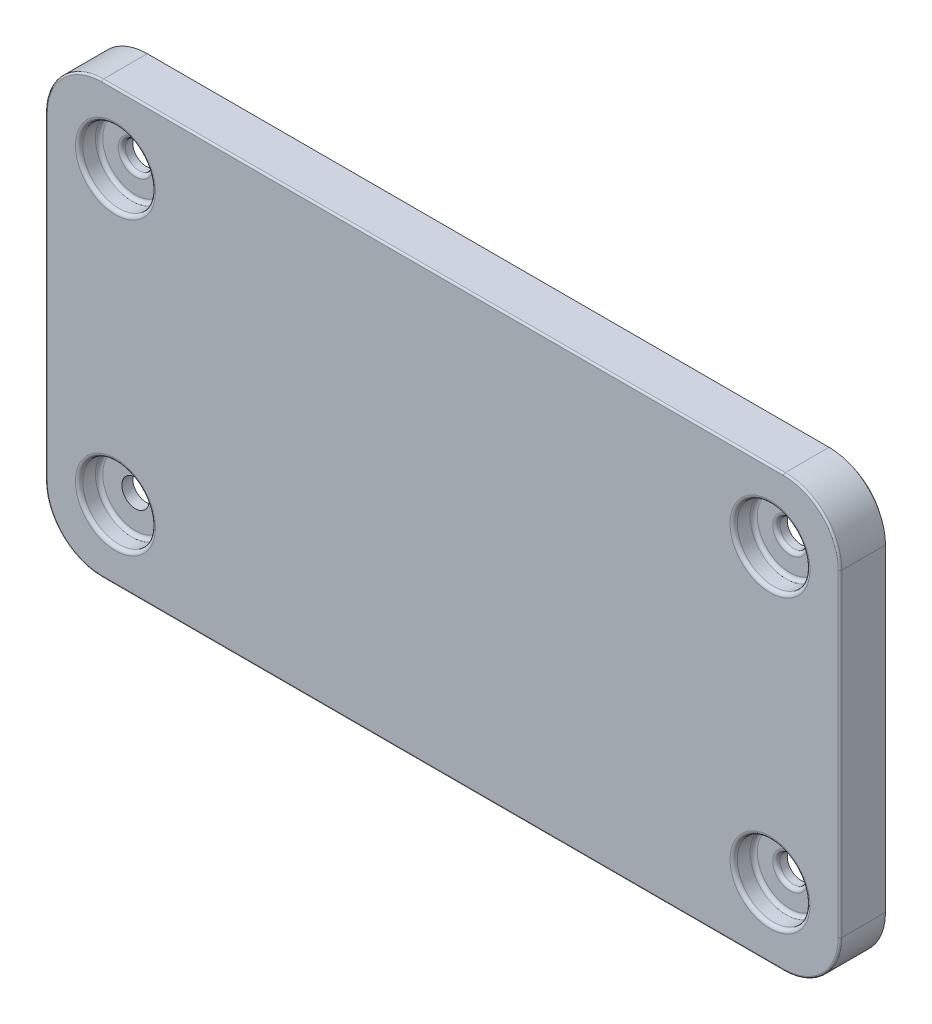
from build123d import *

# Parameters (mm, degrees)
EXTRUDE_1_DEPTH     = 5
EXTRUDE_START       = -1.2
EXTRUDE_2_DEPTH     = 1.2
SKETCH_4_R          = 4
SKETCH_4_R_2        = 1.5
EXTRUDE_3_DEPTH     = 1.2
EXTRUDE_3_2_DEPTH   = 1.2
EXTRUDE_3_3_DEPTH   = 1.2
EXTRUDE_3_4_DEPTH   = 1.2
EXTRUDE_4_REACH     = 96.482
SKETCH_5_R          = 5.2
SKETCH_5_R_2        = 4
SKETCH_6_R          = 4
CUT_EXTRUDE_1_DEPTH = 95.46279818
EXTRUDE_START_2     = 0.6
EXTRUDE_5_DEPTH     = 0.6
CUT_EXTRUDE_2_REACH = 97.858
SKETCH_8_W          = 7.940000079
SKETCH_8_H          = 0.6
CUT_EXTRUDE_3_REACH = 98.25
SKETCH_9_W          = 10.760001831
SKETCH_9_H          = 0.6
SKETCH_9_W_2        = 10.759988403
SKETCH_10_W         = 10.760001831
SKETCH_10_H         = 0.4
SKETCH_10_W_2       = 0.4
SKETCH_10_W_3       = 10.759988403
EXTRUDE_6_DEPTH     = 2.099999937
SKETCH_11_W         = 7.940000079
SKETCH_11_H         = 0.4
SKETCH_11_W_2       = 0.4
EXTRUDE_7_DEPTH     = 2.099999937
FILLET_1_R          = 0.4
FILLET_2_R          = 1.5
FILLET_3_R          = 0.2
CUT_EXTRUDE_4_DEPTH = 0.6


with BuildPart() as part:
    # 草图1 → 凸台-拉伸1 (new body)
    with BuildSketch(Plane.XY.offset(-1.60003744)):
        with BuildLine():
            ThreePointArc((3.699999975, 37.499457172), (1.884295867, 41.884295867), (-2.500542828, 43.699999975))
            Line((-2.500542828, 43.699999975), (-77.499459801, 43.699999975))
            ThreePointArc((-77.499459801, 43.699999975), (-81.884294734, 41.884294734), (-83.699999975, 37.499459801))
            Line((-83.699999975, 37.499459801), (-83.699999975, 2.500538401))
            ThreePointArc((-83.699999975, 2.500538401), (-81.884293959, -1.884293959), (-77.499461599, -3.699999975))
            Line((-77.499461599, -3.699999975), (-2.500541029, -3.699999975))
            ThreePointArc((-2.500541029, -3.699999975), (1.884295092, -1.884295092), (3.699999975, 2.500541029))
            Line((3.699999975, 2.500541029), (3.699999975, 37.499457172))
        make_face()
        with BuildLine():
            Line((2.499999937, 2.500397821), (2.499999936, 37.499600856))
            ThreePointArc((2.499999936, 37.499600856), (1.035767701, 41.035767701), (-2.500399144, 42.499999936))
            Line((-2.500399144, 42.499999936), (-77.499602789, 42.499999937))
            ThreePointArc((-77.499602789, 42.499999937), (-81.035766569, 41.035766569), (-82.499999937, 37.499602789))
            Line((-82.499999937, 37.499602789), (-82.499999937, 2.500395888))
            ThreePointArc((-82.499999937, 2.500395888), (-81.035765794, -1.035765794), (-77.499604112, -2.499999937))
            Line((-77.499604112, -2.499999937), (-2.500397821, -2.499999937))
            ThreePointArc((-2.500397821, -2.499999937), (1.035766926, -1.035766926), (2.499999937, 2.500397821))
        make_face(mode=Mode.SUBTRACT)
    extrude(amount=EXTRUDE_1_DEPTH)

    # 草图3 → 凸台-拉伸2 (add)
    with BuildSketch(Plane.XY.offset(3.39996256).offset(EXTRUDE_START)):
        with BuildLine():
            Line((-2.500542828, 43.699999975), (-77.499459801, 43.699999975))
            ThreePointArc((-77.499459801, 43.699999975), (-81.884294734, 41.884294734), (-83.699999975, 37.499459801))
            Line((-83.699999975, 37.499459801), (-83.699999975, 2.500538401))
            ThreePointArc((-83.699999975, 2.500538401), (-81.884293959, -1.884293959), (-77.499461599, -3.699999975))
            Line((-77.499461599, -3.699999975), (-2.500541029, -3.699999975))
            ThreePointArc((-2.500541029, -3.699999975), (1.884295092, -1.884295092), (3.699999975, 2.500541029))
            Line((3.699999975, 2.500541029), (3.699999975, 37.499457172))
            ThreePointArc((3.699999975, 37.499457172), (1.884295867, 41.884295867), (-2.500542828, 43.699999975))
        make_face()
    extrude(amount=EXTRUDE_2_DEPTH)

    # 草图5 → 凸台-拉伸4 (add, up to next)
    with BuildSketch(Plane(origin=(0, 0, 0), x_dir=(-1, 0, 0), z_dir=(0, 0, -1)), mode=Mode.PRIVATE) as extrude_4_sk1:
        with Locations((76.0000004, 3.99999962)):
            Circle(SKETCH_5_R)
        with Locations((76.0000004, 3.99999962)):
            Circle(SKETCH_5_R_2, mode=Mode.SUBTRACT)
    extrude_4_tool1 = extrude(extrude_4_sk1.sketch, amount=-EXTRUDE_4_REACH, mode=Mode.PRIVATE) - part.part
    # 草图5 → 凸台-拉伸4 (add, up to next)
    with BuildSketch(Plane(origin=(0, 0, 0), x_dir=(-1, 0, 0), z_dir=(0, 0, -1)), mode=Mode.PRIVATE) as extrude_4_sk2:
        with Locations((3.999992, 3.9999793)):
            Circle(SKETCH_5_R)
        with Locations((3.999992, 3.9999793)):
            Circle(SKETCH_5_R_2, mode=Mode.SUBTRACT)
    extrude_4_tool2 = extrude(extrude_4_sk2.sketch, amount=-EXTRUDE_4_REACH, mode=Mode.PRIVATE) - part.part
    # 草图5 → 凸台-拉伸4 (add, up to next)
    with BuildSketch(Plane(origin=(0, 0, 0), x_dir=(-1, 0, 0), z_dir=(0, 0, -1)), mode=Mode.PRIVATE) as extrude_4_sk3:
        with Locations((3.99999962, 35.99999912)):
            Circle(SKETCH_5_R)
        with Locations((3.99999962, 35.99999912)):
            Circle(SKETCH_5_R_2, mode=Mode.SUBTRACT)
    extrude_4_tool3 = extrude(extrude_4_sk3.sketch, amount=-EXTRUDE_4_REACH, mode=Mode.PRIVATE) - part.part
    # 草图5 → 凸台-拉伸4 (add, up to next)
    with BuildSketch(Plane(origin=(0, 0, 0), x_dir=(-1, 0, 0), z_dir=(0, 0, -1)), mode=Mode.PRIVATE) as extrude_4_sk4:
        with Locations((76.0000004, 35.99999912)):
            Circle(SKETCH_5_R)
        with Locations((76.0000004, 35.99999912)):
            Circle(SKETCH_5_R_2, mode=Mode.SUBTRACT)
    extrude_4_tool4 = extrude(extrude_4_sk4.sketch, amount=-EXTRUDE_4_REACH, mode=Mode.PRIVATE) - part.part


with BuildPart() as body_2:
    # 草图4 → 凸台-拉伸3 (new body)
    with BuildSketch(Plane.XY):
        with Locations((-76.0000004, 35.99999912)):
            Circle(SKETCH_4_R)
        with Locations((-76.0000004, 35.99999912)):
            Circle(SKETCH_4_R_2, mode=Mode.SUBTRACT)
    extrude(amount=EXTRUDE_3_DEPTH)


with BuildPart() as body_3:
    # 草图4 → Extrude 3 2 (new body)
    with BuildSketch(Plane.XY):
        with Locations((-3.99999962, 35.99999912)):
            Circle(SKETCH_4_R)
        with Locations((-3.99999962, 35.99999912)):
            Circle(SKETCH_4_R_2, mode=Mode.SUBTRACT)
    extrude(amount=EXTRUDE_3_2_DEPTH)


with BuildPart() as body_4:
    # 草图4 → Extrude 3 3 (new body)
    with BuildSketch(Plane.XY):
        with Locations((-76.0000004, 3.99999962)):
            Circle(SKETCH_4_R)
        with Locations((-76.0000004, 3.99999962)):
            Circle(SKETCH_4_R_2, mode=Mode.SUBTRACT)
    extrude(amount=EXTRUDE_3_3_DEPTH)


with BuildPart() as body_5:
    # 草图4 → Extrude 3 4 (new body)
    with BuildSketch(Plane.XY):
        with Locations((-3.999992, 3.9999793)):
            Circle(SKETCH_4_R)
        with Locations((-3.999992, 3.9999793)):
            Circle(SKETCH_4_R_2, mode=Mode.SUBTRACT)
    extrude(amount=EXTRUDE_3_4_DEPTH)


with BuildPart() as part_1:
    add(part.part)

    add(body_2.part)  # 凸台-拉伸4 merges body 2

    add(body_3.part)  # 凸台-拉伸4 merges body 3

    add(body_4.part)  # 凸台-拉伸4 merges body 4

    add(body_5.part)  # 凸台-拉伸4 merges body 5
    add(extrude_4_tool1.solids().sort_by_distance((-70.947079, 4, 0))[0])
    add(extrude_4_tool2.solids().sort_by_distance((1.05293, 3.999979, 0))[0])
    add(extrude_4_tool3.solids().sort_by_distance((1.052922, 35.999999, 0))[0])
    add(extrude_4_tool4.solids().sort_by_distance((-70.947079, 35.999999, 0))[0])

    # 草图6 → 切除-拉伸1 (cut, through all)
    with BuildSketch(Plane.XY.offset(1.2)):
        with Locations(Location((-76.0000004, 3.99999962, 0), (0, 0, 180))):
            Circle(SKETCH_6_R)
        with Locations(Location((-3.999992, 3.9999793, 0), (0, 0, 180))):
            Circle(SKETCH_6_R)
        with Locations(Location((-3.99999962, 35.99999912, 0), (0, 0, 180))):
            Circle(SKETCH_6_R)
        with Locations(Location((-76.0000004, 35.99999912, 0), (0, 0, 180))):
            Circle(SKETCH_6_R)
    extrude(amount=CUT_EXTRUDE_1_DEPTH, mode=Mode.SUBTRACT)

    # 草图7 → 凸台-拉伸5 (add)
    with BuildSketch(Plane(origin=(0, 0, -1.60003744), x_dir=(-1, 0, 0), z_dir=(0, 0, -1)).offset(EXTRUDE_START_2)):
        with BuildLine():
            Line((-2.899999931, 37.499552961), (-2.899999931, 2.500445557))
            ThreePointArc((-2.899999931, 2.500445557), (-1.318609635, -1.318609635), (2.500445557, -2.899999931))
            Line((2.500445557, -2.899999931), (77.499556608, -2.899999931))
            ThreePointArc((77.499556608, -2.899999931), (81.318608502, -1.318608502), (82.899999932, 2.500443392))
            Line((82.899999932, 2.500443392), (82.899999931, 37.499555126))
            ThreePointArc((82.899999931, 37.499555126), (81.318609277, 41.318609277), (77.499555126, 42.899999931))
            Line((77.499555126, 42.899999931), (2.500447039, 42.899999931))
            ThreePointArc((2.500447039, 42.899999931), (-1.318610409, 41.318610409), (-2.899999931, 37.499552961))
        make_face()
        with BuildLine():
            ThreePointArc((2.500397821, -2.499999937), (-1.035766926, -1.035766926), (-2.499999937, 2.500397821))
            Line((-2.499999937, 2.500397821), (-2.499999936, 37.499600856))
            ThreePointArc((-2.499999936, 37.499600856), (-1.035767701, 41.035767701), (2.500399144, 42.499999936))
            Line((2.500399144, 42.499999936), (77.499602789, 42.499999937))
            ThreePointArc((77.499602789, 42.499999937), (81.035766569, 41.035766569), (82.499999937, 37.499602789))
            Line((82.499999937, 37.499602789), (82.499999937, 2.500395888))
            ThreePointArc((82.499999937, 2.500395888), (81.035765794, -1.035765794), (77.499604112, -2.499999937))
            Line((77.499604112, -2.499999937), (2.500397821, -2.499999937))
        make_face(mode=Mode.SUBTRACT)
    extrude(amount=-EXTRUDE_5_DEPTH)

    # 草图8 → 切除-拉伸2 (cut, up to next)
    with BuildSketch(Plane(origin=(0, 42.899999931, 0), x_dir=(1.0, -4.843868141931495e-12, 0), z_dir=(4.843868141931495e-12, 1.0, 0)), mode=Mode.PRIVATE) as cut_extrude_2_sk1:
        with Locations((-35.991795639, 1.90003744)):
            Rectangle(SKETCH_8_W, SKETCH_8_H)
    cut_extrude_2_tool1 = extrude(cut_extrude_2_sk1.sketch, amount=-CUT_EXTRUDE_2_REACH, mode=Mode.PRIVATE) & part_1.part
    add(cut_extrude_2_tool1.solids().sort_by_distance((-35.991796, 42.9, -1.900037))[0], mode=Mode.SUBTRACT)

    # 草图9 → 切除-拉伸3 (cut, up to next)
    with BuildSketch(Plane.XZ.offset(3.699999975), mode=Mode.PRIVATE) as cut_extrude_3_sk1:
        with Locations((-12.954000404, -1.90003744)):
            Rectangle(SKETCH_9_W, SKETCH_9_H)
    cut_extrude_3_tool1 = extrude(cut_extrude_3_sk1.sketch, amount=-CUT_EXTRUDE_3_REACH, mode=Mode.PRIVATE) & part_1.part
    # 草图9 → 切除-拉伸3 (cut, up to next)
    with BuildSketch(Plane.XZ.offset(3.699999975), mode=Mode.PRIVATE) as cut_extrude_3_sk2:
        with Locations((-39.382703711, -1.90003744)):
            Rectangle(SKETCH_9_W_2, SKETCH_9_H)
    cut_extrude_3_tool2 = extrude(cut_extrude_3_sk2.sketch, amount=-CUT_EXTRUDE_3_REACH, mode=Mode.PRIVATE) & part_1.part
    # 草图9 → 切除-拉伸3 (cut, up to next)
    with BuildSketch(Plane.XZ.offset(3.699999975), mode=Mode.PRIVATE) as cut_extrude_3_sk3:
        with Locations((-65.811399391, -1.90003744)):
            Rectangle(SKETCH_9_W, SKETCH_9_H)
    cut_extrude_3_tool3 = extrude(cut_extrude_3_sk3.sketch, amount=-CUT_EXTRUDE_3_REACH, mode=Mode.PRIVATE) & part_1.part
    add(cut_extrude_3_tool1.solids().sort_by_distance((-12.954, -3.7, -1.900037))[0], mode=Mode.SUBTRACT)
    add(cut_extrude_3_tool2.solids().sort_by_distance((-39.382704, -3.7, -1.900037))[0], mode=Mode.SUBTRACT)
    add(cut_extrude_3_tool3.solids().sort_by_distance((-65.811399, -3.7, -1.900037))[0], mode=Mode.SUBTRACT)

    # 草图10 → 凸台-拉伸6 (add)
    with BuildSketch(Plane(origin=(0, -2.499999937, 0), x_dir=(1.0, 8.18281192767546e-12, 0), z_dir=(-8.18281192767546e-12, 1.0, 0))):
        with Locations((-12.954000404, 1.40003744)):
            Rectangle(SKETCH_10_W, SKETCH_10_H)
        with Locations((-18.534001319, 1.40003744)):
            Rectangle(SKETCH_10_W_2, SKETCH_10_H)
        with Locations((-7.373999488, 1.40003744)):
            Rectangle(SKETCH_10_W_2, SKETCH_10_H)
        with Locations((-39.382703711, 1.40003744)):
            Rectangle(SKETCH_10_W_3, SKETCH_10_H)
        with Locations((-44.962697913, 1.40003744)):
            Rectangle(SKETCH_10_W_2, SKETCH_10_H)
        with Locations((-33.80270951, 1.40003744)):
            Rectangle(SKETCH_10_W_2, SKETCH_10_H)
        with Locations((-65.811399391, 1.40003744)):
            Rectangle(SKETCH_10_W, SKETCH_10_H)
        with Locations((-60.231398475, 1.40003744)):
            Rectangle(SKETCH_10_W_2, SKETCH_10_H)
        with Locations((-71.391400306, 1.40003744)):
            Rectangle(SKETCH_10_W_2, SKETCH_10_H)
    extrude(amount=EXTRUDE_6_DEPTH)

    # 草图11 → 凸台-拉伸7 (add)
    with BuildSketch(Plane(origin=(0, 42.499999936, 0), x_dir=(-1.0, 8.210001404256635e-12, 0), z_dir=(-8.210001404256635e-12, -1.0, 0))):
        with Locations((35.991795639, 1.40003744)):
            Rectangle(SKETCH_11_W, SKETCH_11_H)
        with Locations((40.161795678, 1.40003744)):
            Rectangle(SKETCH_11_W_2, SKETCH_11_H)
        with Locations((31.821795599, 1.40003744)):
            Rectangle(SKETCH_11_W_2, SKETCH_11_H)
    extrude(amount=EXTRUDE_7_DEPTH)

    # 圆角1
    fillet_1_edges = [part_1.edges().sort_by_distance(p)[0] for p in [
        (-70.8000004, 3.99999962, 0),
        (-70.8000004, 3.99999962, 2.19996256),
        (-72.0000004, 3.99999962, 1.2),
        (1.200008, 3.9999793, 0),
        (1.200008, 3.9999793, 2.19996256),
        (-5.499992, 3.9999793, 1.2),
        (8e-06, 3.9999793, 1.2),
        (1.20000038, 35.99999912, 0),
        (1.20000038, 35.99999912, 2.19996256),
        (-5.49999962, 35.99999912, 1.2),
        (3.8e-07, 35.99999912, 1.2),
        (-70.8000004, 35.99999912, 0),
        (-70.8000004, 35.99999912, 2.19996256),
        (-77.5000004, 35.99999912, 1.2),
        (-72.0000004, 35.99999912, 1.2),
        (-72.0000004, 35.99999912, 3.39996256),
        (3.8e-07, 35.99999912, 3.39996256),
        (8e-06, 3.9999793, 3.39996256),
        (-72.0000004, 3.99999962, 3.39996256),
    ]]
    fillet(fillet_1_edges, radius=FILLET_1_R)

    # 圆角2
    fillet_2_edges = [part_1.edges().sort_by_distance(p)[0] for p in [
        (-12.954000404, -2.499999937, -1.20003744),
        (-39.382703712, -2.499999937, -1.20003744),
        (-65.81139939, -2.499999937, -1.20003744),
        (-35.991795638, 42.499999937, -1.20003744),
    ]]
    fillet(fillet_2_edges, radius=FILLET_2_R)

    # 圆角3
    fillet_3_edges = [part_1.edges().sort_by_distance(p)[0] for p in [
        (3.699999975, 19.999999101, 3.39996256),
        (1.884295092, -1.884295092, 3.39996256),
        (-40.000001314, -3.699999975, 3.39996256),
        (-81.884293959, -1.884293959, 3.39996256),
        (-83.699999975, 19.999999101, 3.39996256),
        (-81.884294734, 41.884294734, 3.39996256),
        (-40.000001314, 43.699999975, 3.39996256),
        (1.035767701, 41.035767701, 2.19996256),
        (1.035766926, -1.035766926, 2.19996256),
        (2.499999936, 19.999999339, 2.19996256),
        (-40.000000967, 42.499999937, 2.19996256),
        (-81.035766569, 41.035766569, 2.19996256),
        (-82.499999937, 19.999999339, 2.19996256),
        (-81.035765794, -1.035765794, 2.19996256),
        (-40.000000967, -2.499999937, 2.19996256),
        (1.884295867, 41.884295867, 3.39996256),
    ]]
    fillet(fillet_3_edges, radius=FILLET_3_R)

    # 草图12 → 切除-拉伸4 (cut)
    with BuildSketch(Plane(origin=(0, 0, -2.20003744), x_dir=(-1, 0, 0), z_dir=(0, 0, -1))):
        with BuildLine():
            ThreePointArc((71.26002944, -2.899999931), (71.208682027, -2.702922308), (71.191400306, -2.499999937))
            Line((71.191400306, -2.499999937), (71.191400306, -2.899999931))
            Line((71.191400306, -2.899999931), (71.26002944, -2.899999931))
        make_face()
        with BuildLine():
            ThreePointArc((60.431398475, -2.499999975), (60.41411675, -2.702922327), (60.36276934, -2.899999931))
            Line((60.36276934, -2.899999931), (60.431398475, -2.899999931))
            Line((60.431398475, -2.899999931), (60.431398475, -2.499999937))
        make_face()
        with BuildLine():
            Line((44.762697913, -2.499999937), (44.762697913, -2.899999931))
            Line((44.762697913, -2.899999931), (44.831327048, -2.899999931))
            ThreePointArc((44.831327048, -2.899999931), (44.779979635, -2.702922308), (44.762697913, -2.499999937))
        make_face()
        with BuildLine():
            Line((34.00270951, -2.899999931), (34.00270951, -2.499999937))
            ThreePointArc((34.00270951, -2.499999975), (33.985427785, -2.702922327), (33.934080375, -2.899999931))
            Line((33.934080375, -2.899999931), (34.00270951, -2.899999931))
        make_face()
        with BuildLine():
            Line((18.334001319, -2.899999931), (18.402630454, -2.899999931))
            ThreePointArc((18.402630454, -2.899999931), (18.35128304, -2.702922308), (18.334001319, -2.499999937))
            Line((18.334001319, -2.499999937), (18.334001319, -2.899999931))
        make_face()
        with BuildLine():
            Line((7.573999488, -2.899999931), (7.573999488, -2.499999937))
            ThreePointArc((7.573999488, -2.499999975), (7.556717764, -2.702922327), (7.505370353, -2.899999931))
            Line((7.505370353, -2.899999931), (7.573999488, -2.899999931))
        make_face()
        with BuildLine():
            ThreePointArc((39.961795678, 42.499999937), (39.979077399, 42.702922308), (40.030424812, 42.899999931))
            Line((40.030424812, 42.899999931), (39.961795678, 42.899999931))
            Line((39.961795678, 42.899999931), (39.961795678, 42.499999937))
        make_face()
        with BuildLine():
            Line((32.021795599, 42.499999937), (32.021795599, 42.899999931))
            Line((32.021795599, 42.899999931), (31.953166464, 42.899999931))
            ThreePointArc((31.953166464, 42.899999931), (32.004513874, 42.702922326), (32.021795599, 42.499999975))
        make_face()
    extrude(amount=-CUT_EXTRUDE_4_DEPTH, mode=Mode.SUBTRACT)


solid = part_1.part
